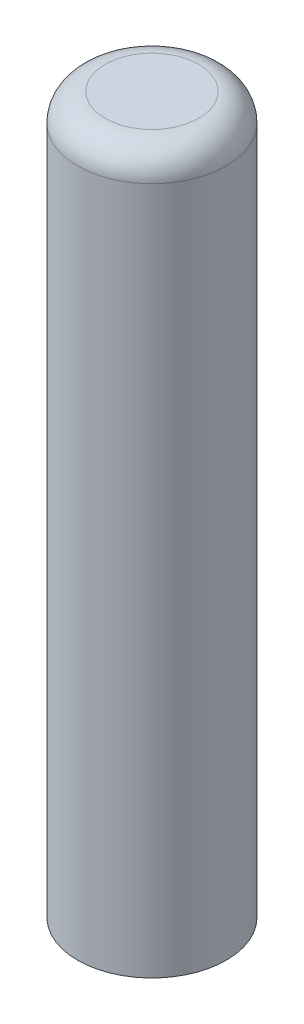
from build123d import *

# Parameters (mm, degrees)
BOSS_EXTRUDE1_DEPTH      = 8
BOSS_EXTRUDE1_DEPTH_BACK = 5
SKETCH1_R                = 1.35
FILLET1_R                = 0.5


with BuildPart() as part:
    # Sketch1 → Boss-Extrude1 (new, two sides: drawn at the far end of the back side and taken through both)
    with BuildSketch(Plane(origin=(0, 0, 0), x_dir=(1, 0, 0), z_dir=(0, 1, 0)).offset(-BOSS_EXTRUDE1_DEPTH_BACK)):
        with Locations(Location((0, 0, 0), (0, 0, 270))):
            Circle(SKETCH1_R)
    extrude(amount=BOSS_EXTRUDE1_DEPTH + BOSS_EXTRUDE1_DEPTH_BACK)

    # Fillet1
    fillet1_edges = [part.edges().sort_by_distance(p)[0] for p in [
        (0, 8, -1.35),
    ]]
    fillet(fillet1_edges, radius=FILLET1_R)


solid = part.part
